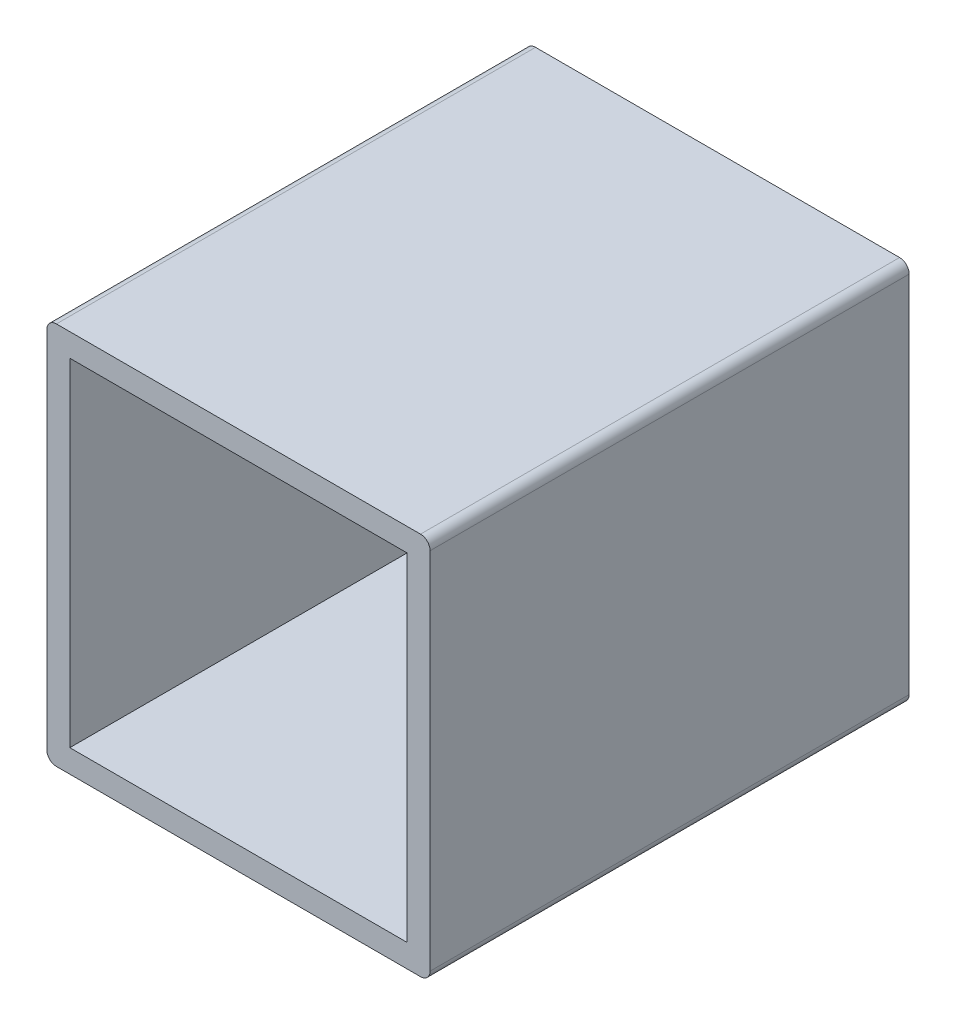
from build123d import *

# Parameters (mm, degrees)
ESBO_O1_W                = 70.4
ESBO_O1_H                = 70.4
RESSALTO_EXTRUS_O1_DEPTH = 50


with BuildPart() as part:
    # Esboço1 → Ressalto-extrusão1 (new, symmetric)
    with BuildSketch(Plane.XY):
        with BuildLine():
            Line((-38, -40), (38, -40))
            ThreePointArc((38, -40), (39.414213562, -39.414213562), (40, -38))
            Line((40, -38), (40, 38))
            ThreePointArc((40, 38), (39.414213562, 39.414213562), (38, 40))
            Line((38, 40), (-38, 40))
            ThreePointArc((-38, 40), (-39.414213562, 39.414213562), (-40, 38))
            Line((-40, 38), (-40, -38))
            ThreePointArc((-40, -38), (-39.414213562, -39.414213562), (-38, -40))
        make_face()
        Rectangle(ESBO_O1_W, ESBO_O1_H, mode=Mode.SUBTRACT)
    extrude(amount=RESSALTO_EXTRUS_O1_DEPTH, both=True)


solid = part.part
